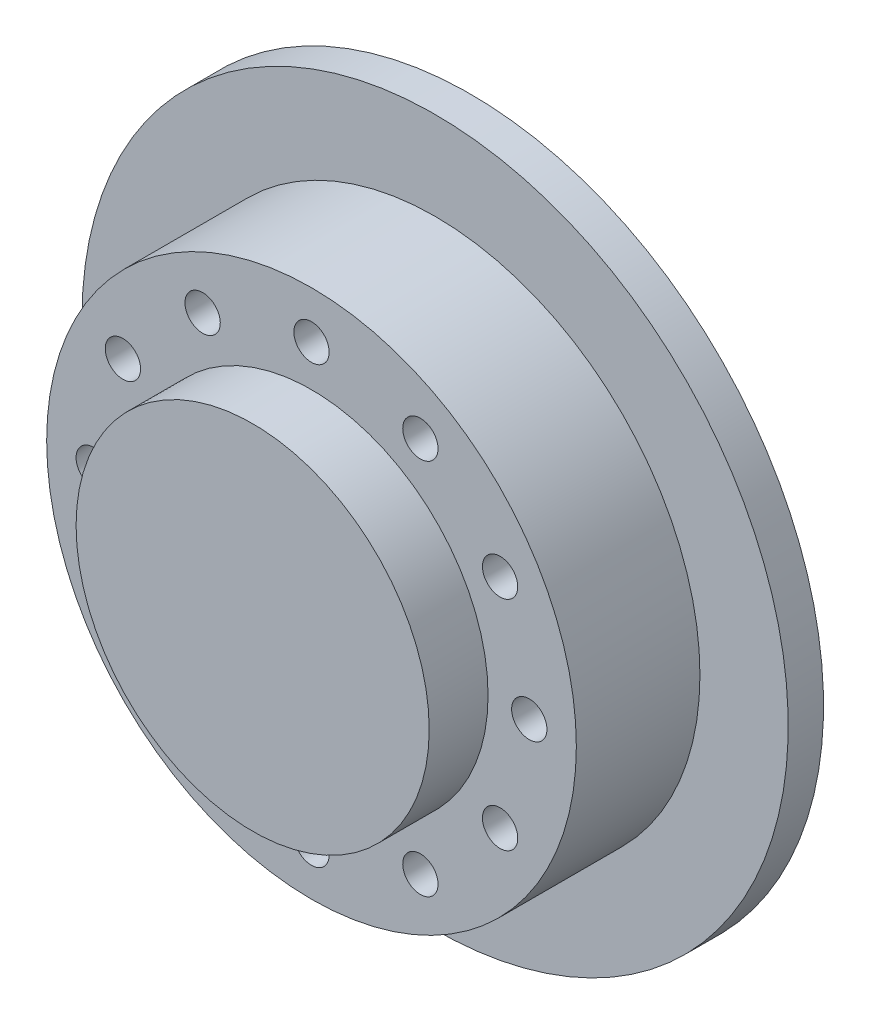
from build123d import *

# Parameters (mm, degrees)
SKETCH_1_R               = 22.5
EXTRUDE_1_DEPTH          = 13.5
SKETCH_2_R               = 15
EXTRUDE_2_DEPTH          = 5
SKETCH_3_R               = 1.5
CUT_EXTRUDE_1_DEPTH      = 5
SKETCH_5_R               = 1.5
CUT_EXTRUDE_2_DEPTH      = 35.565155865
CUT_EXTRUDE_6_DEPTH      = 3
PATTERN_CIRCULAR_1_COUNT = 12
SKETCH_10_R              = 30
SKETCH_10_R_2            = 22.5
EXTRUDE_3_DEPTH          = 3


with BuildPart() as part:
    # 草图1 → 凸台-拉伸1 (new body)
    with BuildSketch(Plane.XY):
        Circle(SKETCH_1_R)
    extrude(amount=EXTRUDE_1_DEPTH)

    # 草图2 → 凸台-拉伸2 (add)
    with BuildSketch(Plane.XY.offset(13.5)):
        Circle(SKETCH_2_R)
    extrude(amount=EXTRUDE_2_DEPTH)

    # 草图3 → 切除-拉伸1 (cut)
    with BuildSketch(Plane.XY.offset(13.5)):
        with Locations((0, 18.5)):
            Circle(SKETCH_3_R)
    cut_extrude_1 = extrude(amount=-CUT_EXTRUDE_1_DEPTH, mode=Mode.SUBTRACT)

    # 草图5 → 切除-拉伸2 (cut, through all)
    with BuildSketch(Plane.XY.offset(13.5)):
        with Locations((0, 18.5)):
            Circle(SKETCH_5_R)
    cut_extrude_2 = extrude(amount=-CUT_EXTRUDE_2_DEPTH, mode=Mode.SUBTRACT)

    # 草图9 → 切除-拉伸6 (cut)
    with BuildSketch(Plane(origin=(0, 0, 0), x_dir=(-1, 0, 0), z_dir=(0, 0, -1))):
        Polygon((1.313991975, 21.705218415), (-2.118804585, 21.240559639), (-3.43279656, 18.035341223), (-1.313991975, 15.294781585), (2.118804585, 15.759440361), (3.43279656, 18.964658777), align=None)
    cut_extrude_6 = extrude(amount=-CUT_EXTRUDE_6_DEPTH, mode=Mode.SUBTRACT)

    # 阵列(圆周)1: 切除-拉伸1, 切除-拉伸2, 切除-拉伸6 ×12 about axis
    pattern_circular_1_axis = Axis((0, 0, 0), (0, 0, 1))
    add([cut_extrude_1.rotate(pattern_circular_1_axis, i * 360 / PATTERN_CIRCULAR_1_COUNT) for i in range(1, PATTERN_CIRCULAR_1_COUNT)], mode=Mode.SUBTRACT)
    add([cut_extrude_2.rotate(pattern_circular_1_axis, i * 360 / PATTERN_CIRCULAR_1_COUNT) for i in range(1, PATTERN_CIRCULAR_1_COUNT)], mode=Mode.SUBTRACT)
    add([cut_extrude_6.rotate(pattern_circular_1_axis, i * 360 / PATTERN_CIRCULAR_1_COUNT) for i in range(1, PATTERN_CIRCULAR_1_COUNT)], mode=Mode.SUBTRACT)


with BuildPart() as body_2:
    # 草图10 → 凸台-拉伸3 (new body)
    with BuildSketch(Plane(origin=(0, 0, 0), x_dir=(-1, 0, 0), z_dir=(0, 0, -1))):
        Circle(SKETCH_10_R)
        Circle(SKETCH_10_R_2, mode=Mode.SUBTRACT)
    extrude(amount=-EXTRUDE_3_DEPTH)


solid = Compound([part.part, body_2.part])
